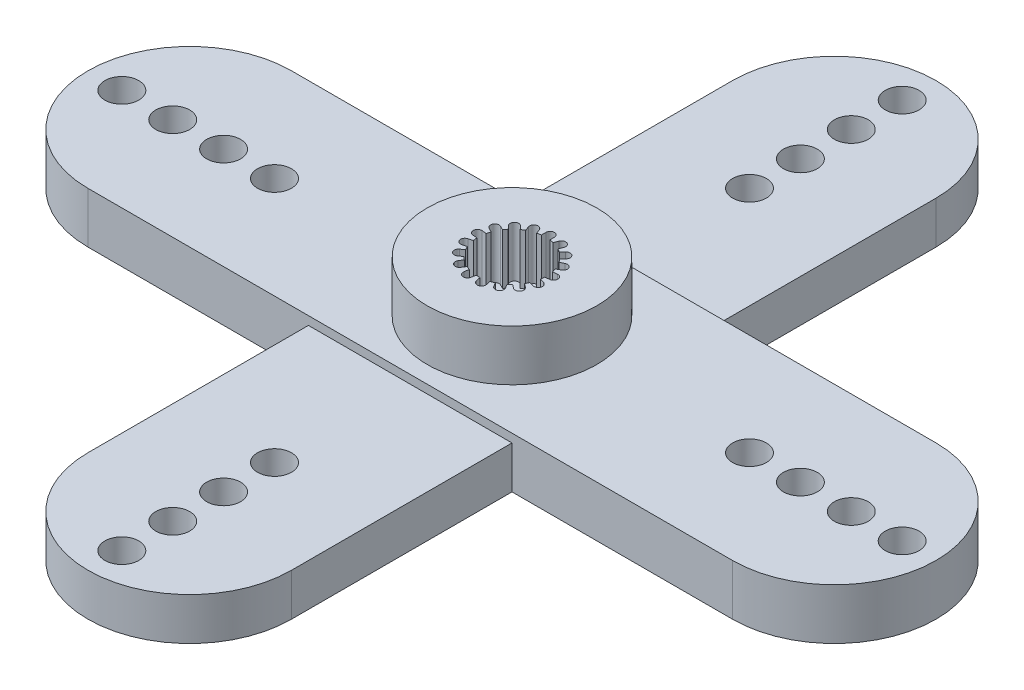
from build123d import *

# Parameters (mm, degrees)
SKETCH1_R           = 5
BOSS_EXTRUDE1_DEPTH = 3
BOSS_EXTRUDE2_DEPTH = 3
BOSS_EXTRUDE3_DEPTH = 2.5
SKETCH4_R           = 3
CUT_EXTRUDE1_DEPTH  = 1
SKETCH5_R           = 1.25
CUT_EXTRUDE2_DEPTH  = 36.707142143
CUT_EXTRUDE3_DEPTH  = 3
SKETCH7_R           = 1
CUT_EXTRUDE4_DEPTH  = 36.860842154


with BuildPart() as part:
    # Sketch1 → Boss-Extrude1 (new body)
    with BuildSketch(Plane(origin=(0, 0, 0), x_dir=(1, 0, 0), z_dir=(0, 1, 0))):
        with Locations(Location((0, 0, 0), (0, 0, 270))):
            Circle(SKETCH1_R)
    extrude(amount=BOSS_EXTRUDE1_DEPTH)

    # Sketch2 → Boss-Extrude2 (add)
    with BuildSketch(Plane.XZ):
        with BuildLine():
            Line((-19, 6), (19, 6))
            ThreePointArc((19, 6), (25, 0), (19, -6))
            Line((19, -6), (-19, -6))
            ThreePointArc((-19, -6), (-25, 0), (-19, 6))
        make_face()
    extrude(amount=BOSS_EXTRUDE2_DEPTH)

    # Sketch3 → Boss-Extrude3 (add)
    with BuildSketch(Plane.XZ.offset(3)):
        with BuildLine():
            Line((-6, -19), (-6, 19))
            ThreePointArc((-6, 19), (0, 25), (6, 19))
            Line((6, 19), (6, -19))
            ThreePointArc((6, -19), (0, -25), (-6, -19))
        make_face()
    extrude(amount=-BOSS_EXTRUDE3_DEPTH)

    # Sketch4 → Cut-Extrude1 (cut)
    with BuildSketch(Plane.XZ.offset(3)):
        with Locations(Location((0, 0, 0), (0, 0, 270))):
            Circle(SKETCH4_R)
    extrude(amount=-CUT_EXTRUDE1_DEPTH, mode=Mode.SUBTRACT)

    # Sketch5 → Cut-Extrude2 (cut, through all)
    with BuildSketch(Plane.XZ.offset(2)):
        with Locations(Location((0, 0, 0), (0, 0, 270))):
            Circle(SKETCH5_R)
    extrude(amount=-CUT_EXTRUDE2_DEPTH, mode=Mode.SUBTRACT)

    # Sketch6 → Cut-Extrude3 (cut)
    with BuildSketch(Plane(origin=(0, 3, 0), x_dir=(1, 0, 0), z_dir=(0, 1, 0))):
        with BuildLine():
            Line((0.25, 2.25), (0.25, 1.984313483))
            ThreePointArc((0.25, 1.984313483), (0.367499036, 1.965946199), (0.483698652, 1.940627634))
            Line((0.483698652, 1.940627634), (0.579675692, 2.188372933))
            ThreePointArc((0.579675692, 2.188372933), (0.903104165, 2.331180574), (1.045911806, 2.0077521))
            Line((1.045911806, 2.0077521), (0.949934766, 1.760006801))
            ThreePointArc((0.949934766, 1.760006801), (1.052864326, 1.700434271), (1.15207112, 1.63484927))
            Line((1.15207112, 1.63484927), (1.331062969, 1.831193975))
            ThreePointArc((1.331062969, 1.831193975), (1.684239109, 1.847522293), (1.700567428, 1.494346153))
            Line((1.700567428, 1.494346153), (1.521575579, 1.298001448))
            ThreePointArc((1.521575579, 1.298001448), (1.596034455, 1.205269273), (1.66485, 1.108275452))
            Line((1.66485, 1.108275452), (1.902682817, 1.226702123))
            ThreePointArc((1.902682817, 1.226702123), (2.237908228, 1.114345889), (2.125551994, 0.779120478))
            Line((2.125551994, 0.779120478), (1.887719178, 0.660693807))
            ThreePointArc((1.887719178, 0.660693807), (1.923651286, 0.54732598), (1.952781662, 0.432022894))
            Line((1.952781662, 0.432022894), (2.217334807, 0.456537353))
            ThreePointArc((2.217334807, 0.456537353), (2.489335441, 0.230670899), (2.263468987, -0.041329735))
            Line((2.263468987, -0.041329735), (1.998915842, -0.065844194))
            ThreePointArc((1.998915842, -0.065844194), (1.991468353, -0.184536719), (1.97697934, -0.30257675))
            Line((1.97697934, -0.30257675), (2.232523445, -0.375285317))
            ThreePointArc((2.232523445, -0.375285317), (2.404564108, -0.684157475), (2.09569195, -0.856198138))
            Line((2.09569195, -0.856198138), (1.840147845, -0.783489572))
            ThreePointArc((1.840147845, -0.783489572), (1.790326583, -0.891476712), (1.734175003, -0.996311728))
            Line((1.734175003, -0.996311728), (1.94619742, -1.156423625))
            ThreePointArc((1.94619742, -1.156423625), (1.995043068, -1.506586591), (1.644880102, -1.555432239))
            Line((1.644880102, -1.555432239), (1.432857685, -1.395320341))
            ThreePointArc((1.432857685, -1.395320341), (1.347391287, -1.478017834), (1.257160723, -1.555489285))
            Line((1.257160723, -1.555489285), (1.39702665, -1.781380515))
            ThreePointArc((1.39702665, -1.781380515), (1.316080407, -2.125542839), (0.971918083, -2.044596596))
            Line((0.971918083, -2.044596596), (0.832052155, -1.818705367))
            ThreePointArc((0.832052155, -1.818705367), (0.722483332, -1.864944459), (0.610359921, -1.904589396))
            Line((0.610359921, -1.904589396), (0.65917969, -2.165752095))
            ThreePointArc((0.65917969, -2.165752095), (0.459373795, -2.457432749), (0.16769314, -2.257626854))
            Line((0.16769314, -2.257626854), (0.118873371, -1.996464155))
            ThreePointArc((0.118873371, -1.996464155), (0, -2), (-0.118873371, -1.996464155))
            Line((-0.118873371, -1.996464155), (-0.16769314, -2.257626854))
            ThreePointArc((-0.16769314, -2.257626854), (-0.459373795, -2.457432749), (-0.65917969, -2.165752095))
            Line((-0.65917969, -2.165752095), (-0.610359921, -1.904589396))
            ThreePointArc((-0.610359921, -1.904589396), (-0.722483332, -1.864944459), (-0.832052155, -1.818705367))
            Line((-0.832052155, -1.818705367), (-0.971918083, -2.044596596))
            ThreePointArc((-0.971918083, -2.044596596), (-1.316080407, -2.125542839), (-1.39702665, -1.781380515))
            Line((-1.39702665, -1.781380515), (-1.257160723, -1.555489285))
            ThreePointArc((-1.257160723, -1.555489285), (-1.347391287, -1.478017834), (-1.432857685, -1.395320341))
            Line((-1.432857685, -1.395320341), (-1.644880102, -1.555432239))
            ThreePointArc((-1.644880102, -1.555432239), (-1.995043068, -1.506586591), (-1.94619742, -1.156423625))
            Line((-1.94619742, -1.156423625), (-1.734175003, -0.996311728))
            ThreePointArc((-1.734175003, -0.996311728), (-1.790326583, -0.891476712), (-1.840147845, -0.783489572))
            Line((-1.840147845, -0.783489572), (-2.09569195, -0.856198138))
            ThreePointArc((-2.09569195, -0.856198138), (-2.404564108, -0.684157475), (-2.232523445, -0.375285317))
            Line((-2.232523445, -0.375285317), (-1.97697934, -0.30257675))
            ThreePointArc((-1.97697934, -0.30257675), (-1.991468353, -0.184536719), (-1.998915842, -0.065844194))
            Line((-1.998915842, -0.065844194), (-2.263468987, -0.041329735))
            ThreePointArc((-2.263468987, -0.041329735), (-2.489335441, 0.230670899), (-2.217334807, 0.456537353))
            Line((-2.217334807, 0.456537353), (-1.952781662, 0.432022894))
            ThreePointArc((-1.952781662, 0.432022894), (-1.923651286, 0.54732598), (-1.887719178, 0.660693807))
            Line((-1.887719178, 0.660693807), (-2.125551994, 0.779120478))
            ThreePointArc((-2.125551994, 0.779120478), (-2.237908228, 1.114345889), (-1.902682817, 1.226702123))
            Line((-1.902682817, 1.226702123), (-1.66485, 1.108275452))
            ThreePointArc((-1.66485, 1.108275452), (-1.596034455, 1.205269273), (-1.521575579, 1.298001448))
            Line((-1.521575579, 1.298001448), (-1.700567428, 1.494346153))
            ThreePointArc((-1.700567428, 1.494346153), (-1.684239109, 1.847522293), (-1.331062969, 1.831193975))
            Line((-1.331062969, 1.831193975), (-1.15207112, 1.63484927))
            ThreePointArc((-1.15207112, 1.63484927), (-1.052864326, 1.700434271), (-0.949934766, 1.760006801))
            Line((-0.949934766, 1.760006801), (-1.045911806, 2.0077521))
            ThreePointArc((-1.045911806, 2.0077521), (-0.903104165, 2.331180574), (-0.579675692, 2.188372933))
            Line((-0.579675692, 2.188372933), (-0.483698652, 1.940627634))
            ThreePointArc((-0.483698652, 1.940627634), (-0.367499036, 1.965946199), (-0.25, 1.984313483))
            Line((-0.25, 1.984313483), (-0.25, 2.25))
            ThreePointArc((-0.25, 2.25), (0, 2.5), (0.25, 2.25))
        make_face()
    extrude(amount=-CUT_EXTRUDE3_DEPTH, mode=Mode.SUBTRACT)

    # Sketch7 → Cut-Extrude4 (cut, through all)
    with BuildSketch(Plane.XZ.offset(3)):
        with Locations(Location((0, 23, 0), (0, 0, 270))):
            Circle(SKETCH7_R)
        with Locations(Location((0, 20, 0), (0, 0, 270))):
            Circle(SKETCH7_R)
        with Locations(Location((0, 17, 0), (0, 0, 270))):
            Circle(SKETCH7_R)
        with Locations(Location((0, 14, 0), (0, 0, 270))):
            Circle(SKETCH7_R)
        with Locations(Location((23, 0, 0), (0, 0, 270))):
            Circle(SKETCH7_R)
        with Locations(Location((20, 0, 0), (0, 0, 270))):
            Circle(SKETCH7_R)
        with Locations(Location((17, 0, 0), (0, 0, 270))):
            Circle(SKETCH7_R)
        with Locations(Location((14, 0, 0), (0, 0, 270))):
            Circle(SKETCH7_R)
        with Locations(Location((0, -23, 0), (0, 0, 270))):
            Circle(SKETCH7_R)
        with Locations(Location((0, -20, 0), (0, 0, 270))):
            Circle(SKETCH7_R)
        with Locations(Location((0, -17, 0), (0, 0, 270))):
            Circle(SKETCH7_R)
        with Locations(Location((0, -14, 0), (0, 0, 270))):
            Circle(SKETCH7_R)
        with Locations(Location((-23, 0, 0), (0, 0, 270))):
            Circle(SKETCH7_R)
        with Locations(Location((-20, 0, 0), (0, 0, 270))):
            Circle(SKETCH7_R)
        with Locations(Location((-17, 0, 0), (0, 0, 270))):
            Circle(SKETCH7_R)
        with Locations(Location((-14, 0, 0), (0, 0, 270))):
            Circle(SKETCH7_R)
    extrude(amount=-CUT_EXTRUDE4_DEPTH, mode=Mode.SUBTRACT)


solid = part.part
